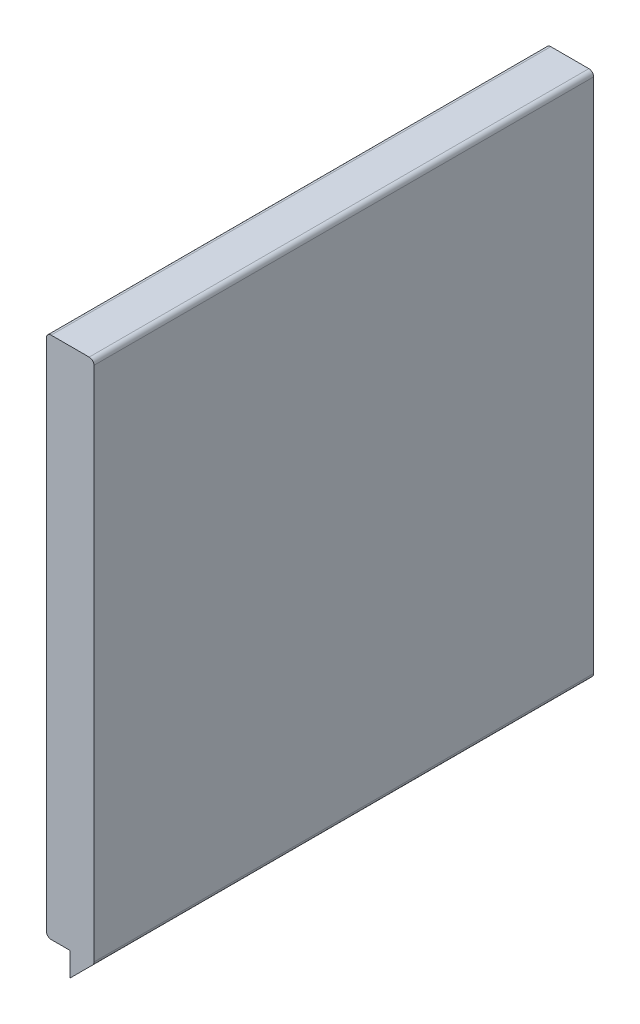
from build123d import *

# Parameters (mm, degrees)
BOSS_EXTRUDE1_DEPTH = 52.5
FILLET1_R           = 1


with BuildPart() as part:
    # Sketch1 → Boss-Extrude1 (new, symmetric)
    with BuildSketch(Plane.XY):
        Polygon((5, -55), (5, -60), (10, -55), (10, 55), (0, 55), (0, -55), align=None)
    extrude(amount=BOSS_EXTRUDE1_DEPTH, both=True)

    # Fillet1
    fillet1_edges = [part.edges().sort_by_distance(p)[0] for p in [
        (10, -55, 0),
        (0, -55, 0),
        (0, 55, 0),
        (10, 55, 0),
    ]]
    fillet(fillet1_edges, radius=FILLET1_R)


solid = part.part
